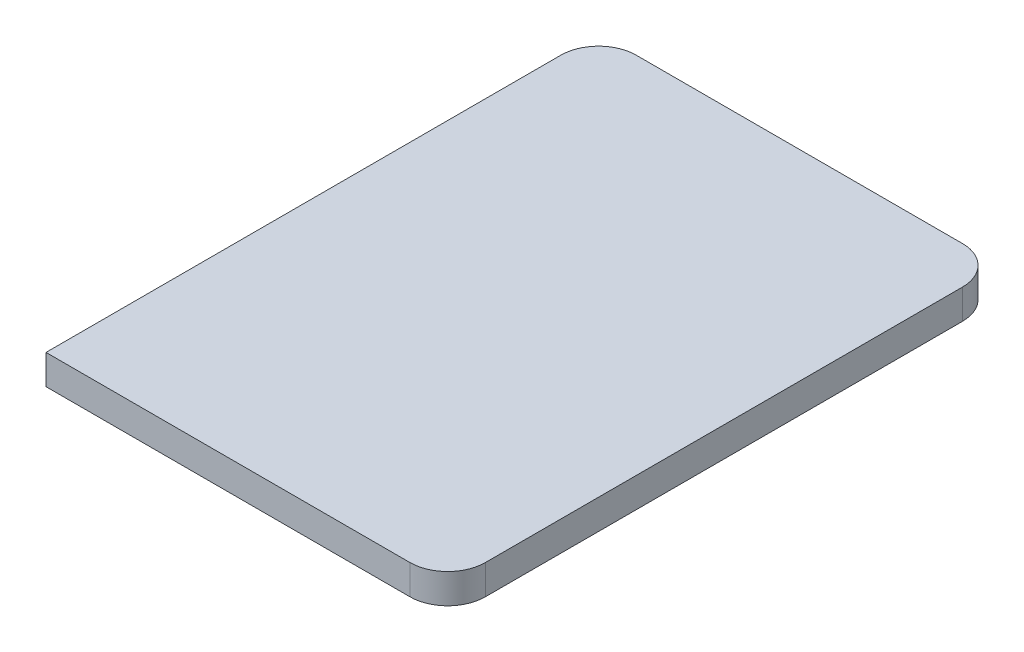
from build123d import *

# Parameters (mm, degrees)
BOSS_EXTRUDE2_DEPTH = 1.575


with BuildPart() as part:
    # Sketch2 → Boss-Extrude2 (new body)
    with BuildSketch(Plane(origin=(0, 0, 0), x_dir=(1, 0, 0), z_dir=(0, 1, 0))):
        with BuildLine():
            Line((0, 2), (0, 0))
            Line((0, 0), (2, 0))
            Line((2, 0), (19.3, 0))
            ThreePointArc((19.3, 0), (20.714213562, 0.585786438), (21.3, 2))
            Line((21.3, 2), (21.3, 27.3))
            ThreePointArc((21.3, 27.3), (20.714213562, 28.714213562), (19.3, 29.3))
            Line((19.3, 29.3), (2, 29.3))
            ThreePointArc((2, 29.3), (0.585786438, 28.714213562), (0, 27.3))
            Line((0, 27.3), (0, 2))
        make_face()
    extrude(amount=BOSS_EXTRUDE2_DEPTH)


solid = part.part
